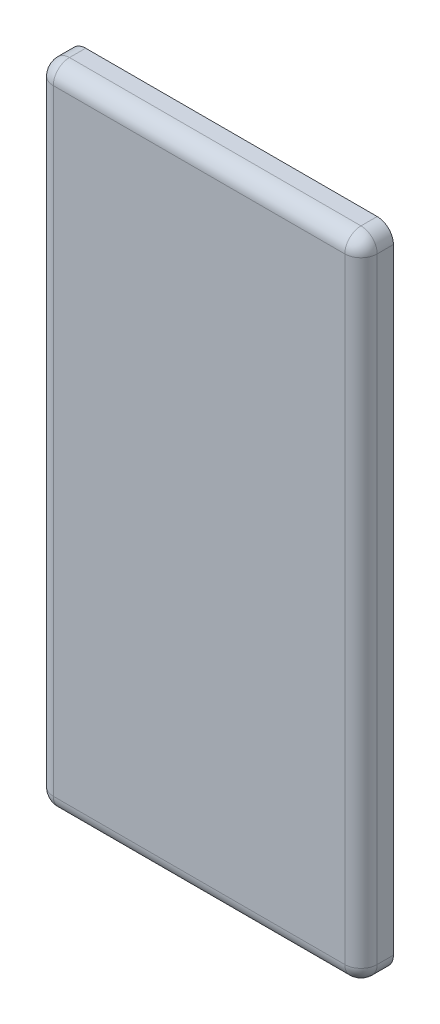
from build123d import *

# Parameters (mm, degrees)
CAP_SKETCH_W            = 20
CAP_SKETCH_H            = 40
EXTRUDE_THICKNESS_DEPTH = 2
CORNER_FILLETS_R        = 1
TOP_EDGE_FILLET_R       = 1


with BuildPart() as part:
    # Cap Sketch → Extrude Thickness (new body)
    with BuildSketch(Plane.XY):
        Rectangle(CAP_SKETCH_W, CAP_SKETCH_H)
    extrude(amount=EXTRUDE_THICKNESS_DEPTH)

    # Corner Fillets
    corner_fillets_edges = [part.edges().sort_by_distance(p)[0] for p in [
        (10, -20, 1),
        (-10, -20, 1),
        (-10, 20, 1),
        (10, 20, 1),
    ]]
    fillet(corner_fillets_edges, radius=CORNER_FILLETS_R)

    # Top Edge Fillet
    top_edge_fillet_edges = [part.edges().sort_by_distance(p)[0] for p in [
        (0, -20, 2),
        (-10, 0, 2),
        (10, 0, 2),
        (0, 20, 2),
        (9.707106781, -19.707106781, 2),
        (9.707106781, 19.707106781, 2),
        (-9.707106781, 19.707106781, 2),
        (-9.707106781, -19.707106781, 2),
    ]]
    fillet(top_edge_fillet_edges, radius=TOP_EDGE_FILLET_R)


solid = part.part
